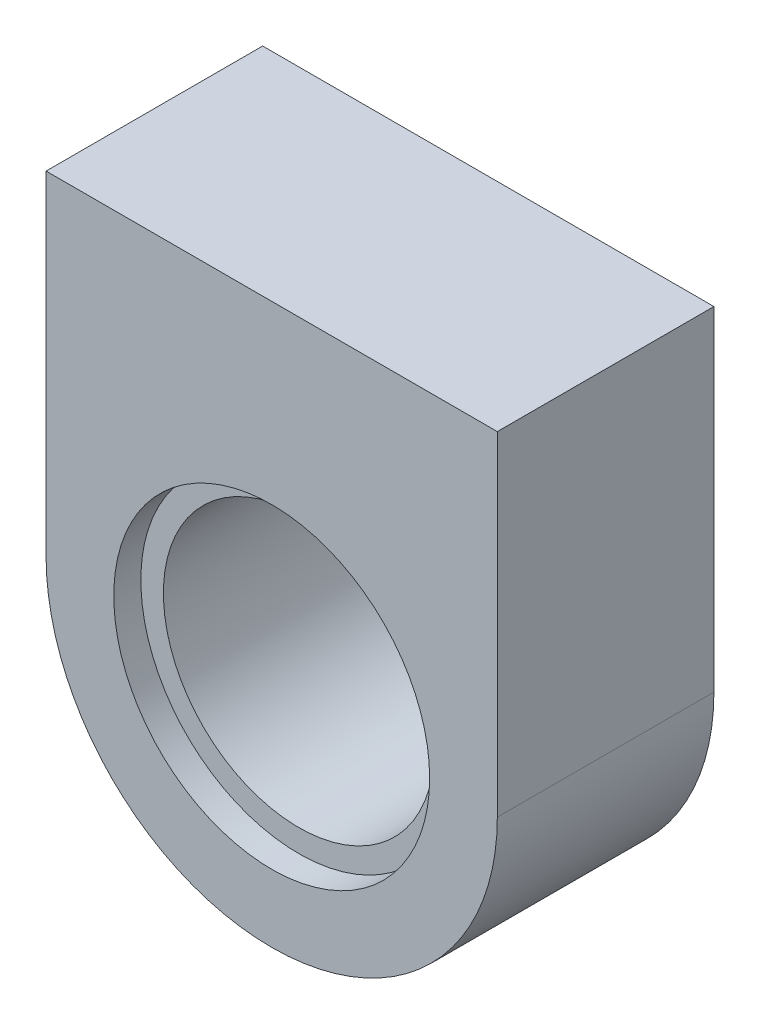
from build123d import *

# Parameters (mm, degrees)
EXTRUDE_1_DEPTH     = 24
SKETCH_2_R          = 17.5
CUT_EXTRUDE_1_DEPTH = 3
CUT_EXTRUDE_2_REACH = 51.346
SKETCH_3_R          = 15


with BuildPart() as part:
    # 草图1 → 凸台-拉伸1 (new body)
    with BuildSketch(Plane.XY):
        with BuildLine():
            Line((-25, 0), (-25, 37))
            Line((-25, 37), (25, 37))
            Line((25, 37), (25, 0))
            ThreePointArc((25, 0), (0, -25), (-25, 0))
        make_face()
    extrude(amount=EXTRUDE_1_DEPTH)

    # 草图2 → 切除-拉伸1 (cut)
    with BuildSketch(Plane.XY.offset(24)):
        Circle(SKETCH_2_R)
    extrude(amount=-CUT_EXTRUDE_1_DEPTH, mode=Mode.SUBTRACT)

    # 草图3 → 切除-拉伸2 (cut, up to next)
    with BuildSketch(Plane.XY.offset(21), mode=Mode.PRIVATE) as cut_extrude_2_sk1:
        Circle(SKETCH_3_R)
    cut_extrude_2_tool1 = extrude(cut_extrude_2_sk1.sketch, amount=-CUT_EXTRUDE_2_REACH, mode=Mode.PRIVATE) & part.part
    add(cut_extrude_2_tool1.solids().sort_by_distance((0, 0, 21))[0], mode=Mode.SUBTRACT)


solid = part.part
